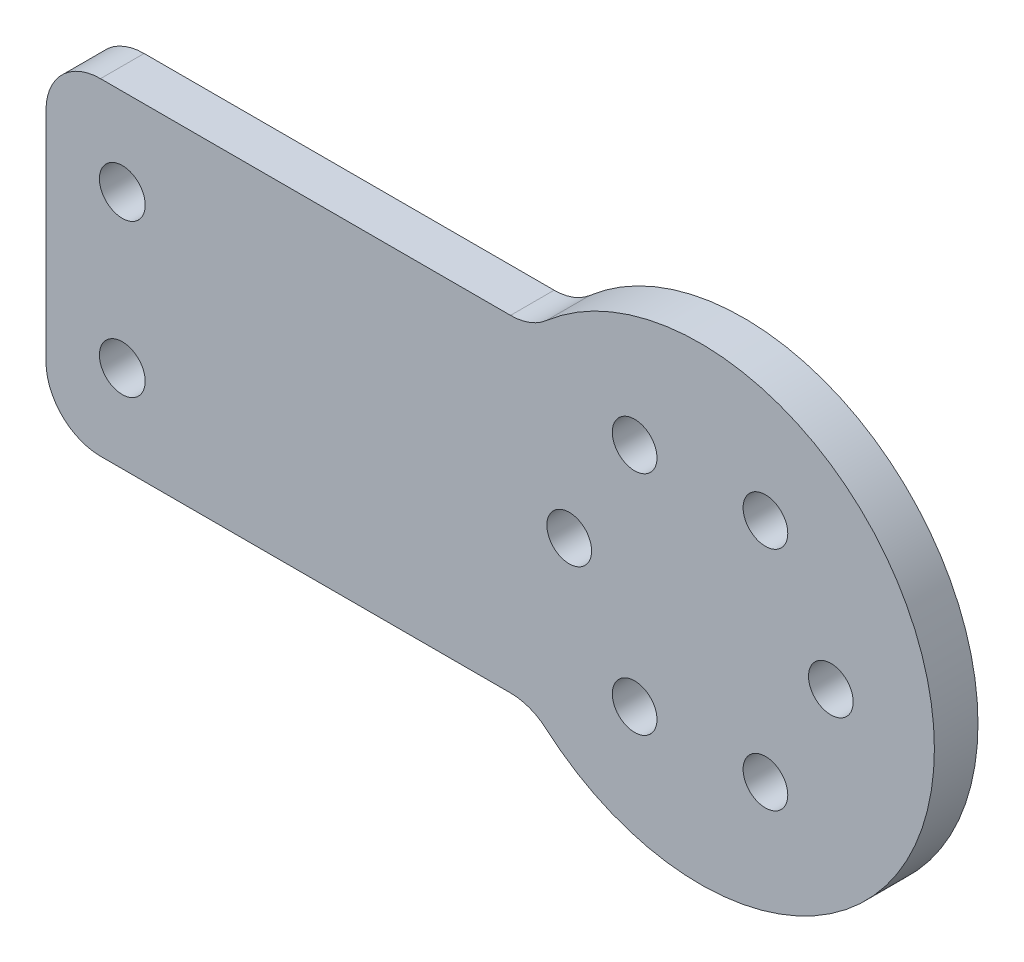
from build123d import *

# Parameters (mm, degrees)
SKETCH_1_R          = 2.05
EXTRUDE_1_DEPTH     = 4
SKETCH_2_R          = 2.1
CUT_EXTRUDE_1_DEPTH = 64.861177565
FILLET_1_R          = 5


with BuildPart() as part:
    # 草图1 → 凸台-拉伸1 (new body)
    with BuildSketch(Plane.XY):
        with BuildLine():
            Line((-60, 0), (-60, 15))
            Line((-60, 15), (-15.402921801, 15))
            ThreePointArc((-15.402921801, 15), (21.5, 0), (-15.402921801, -15))
            Line((-15.402921801, -15), (-60, -15))
            Line((-60, -15), (-60, 0))
        make_face()
        with Locations((12, 0)):
            Circle(SKETCH_1_R, mode=Mode.SUBTRACT)
        with Locations((6, -10.392304845)):
            Circle(SKETCH_1_R, mode=Mode.SUBTRACT)
        with Locations((-6, -10.392304845)):
            Circle(SKETCH_1_R, mode=Mode.SUBTRACT)
        with Locations((-12, 0)):
            Circle(SKETCH_1_R, mode=Mode.SUBTRACT)
        with Locations((-6, 10.392304845)):
            Circle(SKETCH_1_R, mode=Mode.SUBTRACT)
        with Locations((6, 10.392304845)):
            Circle(SKETCH_1_R, mode=Mode.SUBTRACT)
    extrude(amount=EXTRUDE_1_DEPTH)

    # 草图2 → 切除-拉伸1 (cut, through all)
    with BuildSketch(Plane.XY.offset(4)):
        with Locations((-53, 7)):
            Circle(SKETCH_2_R)
        with Locations((-53, -7)):
            Circle(SKETCH_2_R)
    extrude(amount=-CUT_EXTRUDE_1_DEPTH, mode=Mode.SUBTRACT)

    # 圆角1
    fillet_1_edges = [part.edges().sort_by_distance(p)[0] for p in [
        (-15.402921801, -15, 2),
        (-60, -15, 2),
        (-60, 15, 2),
        (-15.402921801, 15, 2),
    ]]
    fillet(fillet_1_edges, radius=FILLET_1_R)


solid = part.part
